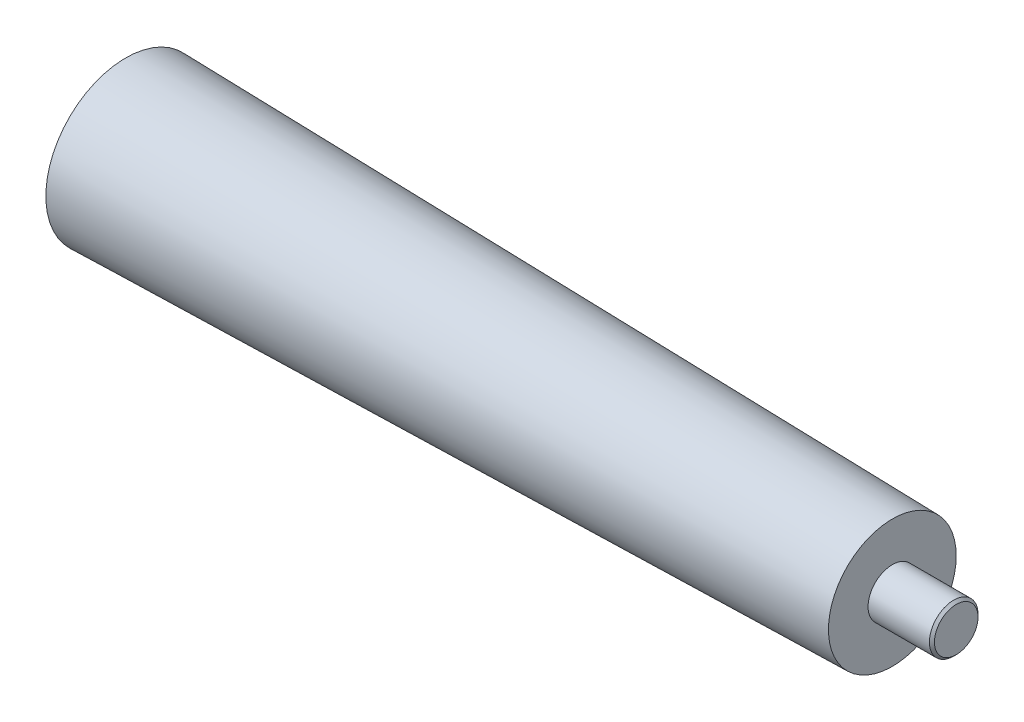
from build123d import *


with BuildPart() as part:
    # Sketch1 → Revolve1 (revolve)
    with BuildSketch(Plane.XY, mode=Mode.PRIVATE) as revolve1_sk:
        Polygon((-82.55, 0), (-82.55, 15.88), (69.85, 12.7), (69.85, 4.83), (82.05, 4.83), (82.55, 4.33), (82.55, 0), align=None)
    revolve(revolve1_sk.sketch.rotate(Axis((82.55, 0, 0), (-1, 0, 0)), 90), axis=Axis((82.55, 0, 0), (-1, 0, 0)))


solid = part.part
